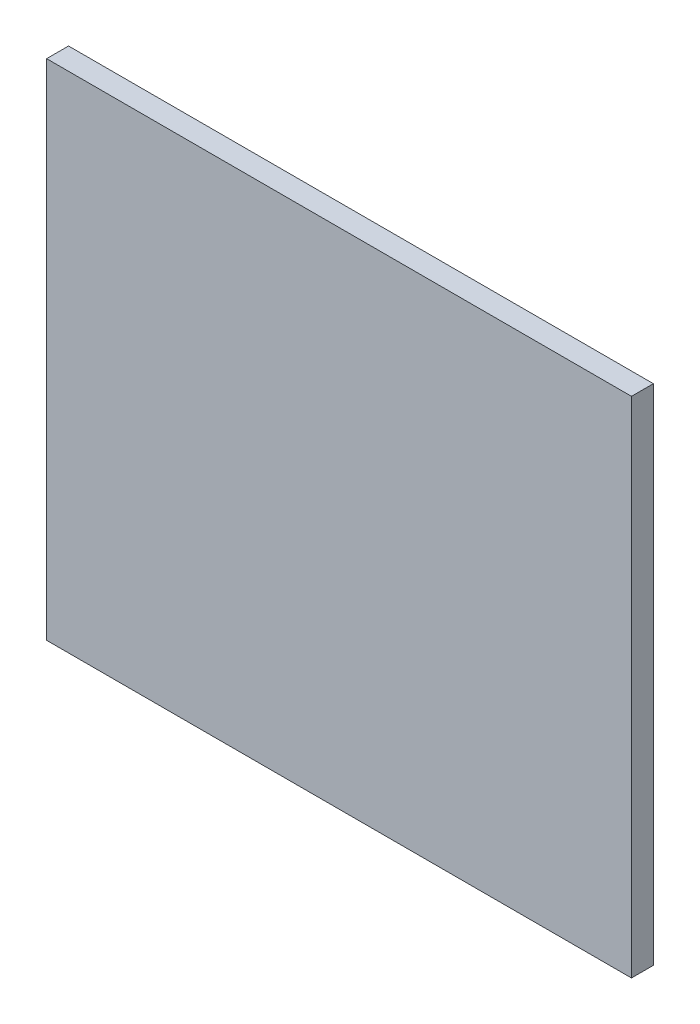
from build123d import *

# Parameters (mm, degrees)
CROQUIS1_W              = 339
CROQUIS1_H              = 292
SALIENTE_EXTRUIR1_DEPTH = 12.7


with BuildPart() as part:
    # Croquis1 → Saliente-Extruir1 (new body)
    with BuildSketch(Plane.XY):
        Rectangle(CROQUIS1_W, CROQUIS1_H)
    extrude(amount=SALIENTE_EXTRUIR1_DEPTH)


solid = part.part
